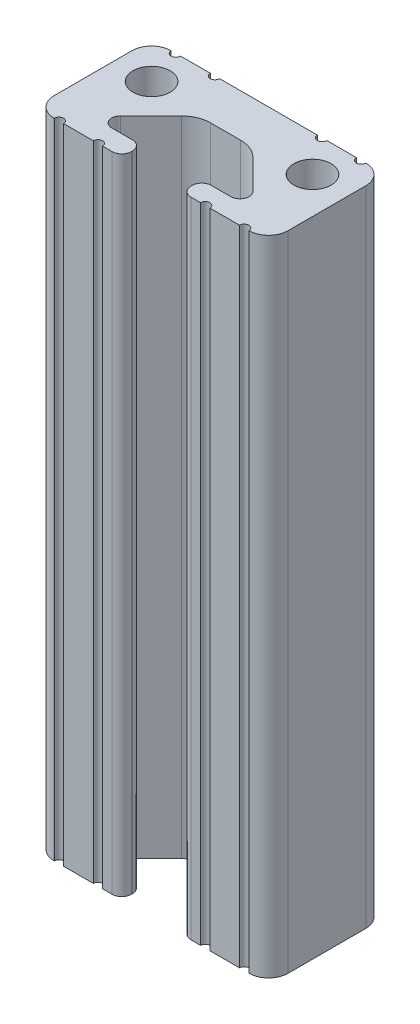
from build123d import *

# Parameters (mm, degrees)
SKETCH11_R                      = 2.032
F_10_1050_PROFILE_1_DEPTH       = 69.85
SKETCH14_R                      = 2.032
SKETCH14_R_2                    = 1.5
BOSS_EXTRUDE1_DEPTH             = 10
BOSS_EXTRUDE1_2_DEPTH           = 10
F_10_32_TAPPED_HOLE3_AT_2_COUNT = 2
F_10_32_TAPPED_HOLE3_AT_2_PITCH = 17.4752
SKETCH17_R                      = 2.032
SKETCH17_R_2                    = 1.25
BOSS_EXTRUDE2_DEPTH             = 10
BOSS_EXTRUDE2_2_DEPTH           = 10
F_10_32_TAPPED_HOLE4_AT_2_COUNT = 2
F_10_32_TAPPED_HOLE4_AT_2_PITCH = 17.4752


with BuildPart() as part:
    # Sketch11 → 10 1050 PROFILE(1) (new body)
    with BuildSketch(Plane(origin=(0, 0, 0), x_dir=(-1, 0, 0), z_dir=(0, 1, 0))):
        with BuildLine():
            Line((9.551093887, 6.35), (6.330982008, 6.35))
            ThreePointArc((6.330982008, 6.35), (5.824379679, 5.843397671), (5.31777735, 6.35))
            Line((5.31777735, 6.35), (4.28752, 6.35))
            ThreePointArc((4.28752, 6.35), (3.545750844, 6.042749156), (3.2385, 5.30098))
            Line((3.2385, 5.30098), (3.2385, 5.18922))
            ThreePointArc((3.2385, 5.18922), (3.545750844, 4.447450844), (4.28752, 4.1402))
            Line((4.28752, 4.1402), (6.541264932, 4.1402))
            ThreePointArc((6.541264932, 4.1402), (7.403778411, 3.563601238), (7.200674335, 2.54618079))
            Line((7.200674335, 2.54618079), (3.874487735, -0.773919123))
            ThreePointArc((3.874487735, -0.773919123), (2.845157282, -1.460673567), (1.631480681, -1.7018))
            Line((1.631480681, -1.7018), (-1.631480681, -1.7018))
            ThreePointArc((-1.631480681, -1.7018), (-2.845157282, -1.460673567), (-3.874487735, -0.773919123))
            Line((-3.874487735, -0.773919123), (-7.091634343, 2.437340333))
            ThreePointArc((-7.091634343, 2.437340333), (-7.30860647, 3.524230776), (-6.387200124, 4.1402))
            Line((-6.387200124, 4.1402), (-4.28752, 4.1402))
            ThreePointArc((-4.28752, 4.1402), (-3.545750844, 4.447450844), (-3.2385, 5.18922))
            Line((-3.2385, 5.18922), (-3.2385, 5.30098))
            ThreePointArc((-3.2385, 5.30098), (-3.545750844, 6.042749156), (-4.28752, 6.35))
            Line((-4.28752, 6.35), (-5.319235427, 6.35))
            ThreePointArc((-5.319235427, 6.35), (-5.825837756, 5.843397671), (-6.332440085, 6.35))
            Line((-6.332440085, 6.35), (-9.552501021, 6.35))
            ThreePointArc((-9.552501021, 6.35), (-10.056951984, 5.843402239), (-10.565687406, 6.345697309))
            Line((-10.565687406, 6.345697309), (-10.591304516, 6.345701455))
            ThreePointArc((-10.591304516, 6.345701455), (-12.082359481, 5.728298321), (-12.7, 4.237343309))
            Line((-12.7, 4.237343309), (-12.7, -4.233074923))
            ThreePointArc((-12.7, -4.233074923), (-12.072915167, -5.733409532), (-10.564685825, -6.341261141))
            ThreePointArc((-10.564685825, -6.341261141), (-10.053713904, -5.834598435), (-9.551557924, -6.35))
            Line((-9.551557924, -6.35), (-6.323021107, -6.35))
            ThreePointArc((-6.323021107, -6.35), (-5.816495529, -5.83457959), (-5.309969951, -6.35))
            Line((-5.309969951, -6.35), (5.309969951, -6.35))
            ThreePointArc((5.309969951, -6.35), (5.816495529, -5.83457959), (6.323021107, -6.35))
            Line((6.323021107, -6.35), (9.550160942, -6.35))
            ThreePointArc((9.550160942, -6.35), (10.051855758, -5.834602622), (10.563288148, -6.340338775))
            Line((10.563288148, -6.340338775), (10.589922543, -6.34049468))
            ThreePointArc((10.589922543, -6.34049468), (12.081868228, -5.723579066), (12.7, -4.23213684))
            Line((12.7, -4.23213684), (12.7, 4.244714967))
            ThreePointArc((12.7, 4.244714967), (12.082266163, 5.735759476), (10.591047766, 6.353073372))
            Line((10.591047766, 6.353073372), (10.564289268, 6.353065837))
            ThreePointArc((10.564289268, 6.353065837), (10.059229141, 5.84339999), (9.551093887, 6.35))
        make_face()
        with Locations((-8.7376, -2.3876)):
            Circle(SKETCH11_R, mode=Mode.SUBTRACT)
        with Locations((8.7376, -2.3876)):
            Circle(SKETCH11_R, mode=Mode.SUBTRACT)
    extrude(amount=F_10_1050_PROFILE_1_DEPTH)


with BuildPart() as body_2:
    # Sketch14 → Boss-Extrude1 (new body)
    with BuildSketch(Plane(origin=(0, 69.85, 0), x_dir=(1, 0, 0), z_dir=(0, 1, 0))):
        with Locations(Location((8.7376, 2.3876, 0), (0, 0, 270))):
            Circle(SKETCH14_R)
        with Locations(Location((8.7376, 2.3876, 0), (0, 0, 270))):
            Circle(SKETCH14_R_2, mode=Mode.SUBTRACT)
    extrude(amount=-BOSS_EXTRUDE1_DEPTH)


with BuildPart() as body_3:
    # Sketch14 → Boss-Extrude1 2 (new body)
    with BuildSketch(Plane(origin=(0, 69.85, 0), x_dir=(1, 0, 0), z_dir=(0, 1, 0))):
        with Locations(Location((-8.7376, 2.3876, 0), (0, 0, 270))):
            Circle(SKETCH14_R)
        with Locations(Location((-8.7376, 2.3876, 0), (0, 0, 270))):
            Circle(SKETCH14_R_2, mode=Mode.SUBTRACT)
    extrude(amount=-BOSS_EXTRUDE1_2_DEPTH)

    # Sketch16 → #10-32 Tapped Hole3 (revolve, cut)
    with BuildSketch(Plane(origin=(-8.7376, 69.85, -2.3876), x_dir=(0, 0, 1), z_dir=(1, 0, 0))):
        Polygon((0, 0), (0, 13.243317848), (2.0193, 12.03), (2.0193, 0), align=None)
    f_10_32_tapped_hole3 = revolve(axis=Axis((-8.7376, 76.2, -2.3876), (0, -1, 0)), mode=Mode.SUBTRACT)


with BuildPart() as body_2_1:
    add(body_2.part)

    # #10-32 Tapped Hole3 at 2: #10-32 Tapped Hole3 ×2
    with Locations(*[(i * F_10_32_TAPPED_HOLE3_AT_2_PITCH, 0, 0) for i in range(1, F_10_32_TAPPED_HOLE3_AT_2_COUNT)]):
        add(f_10_32_tapped_hole3, mode=Mode.SUBTRACT)


with BuildPart() as body_4:
    # Sketch17 → Boss-Extrude2 (new body)
    with BuildSketch(Plane.XZ):
        with Locations(Location((-8.7376, -2.3876, 0), (0, 0, 270))):
            Circle(SKETCH17_R)
        with Locations(Location((-8.7376, -2.3876, 0), (0, 0, 270))):
            Circle(SKETCH17_R_2, mode=Mode.SUBTRACT)
    extrude(amount=-BOSS_EXTRUDE2_DEPTH)

    # Sketch19 → #10-32 Tapped Hole4 (revolve, cut)
    with BuildSketch(Plane(origin=(-8.7376, 0, -2.3876), x_dir=(0, 0, -1), z_dir=(1, 0, 0))):
        Polygon((0, 0), (0, 13.243317848), (2.0193, 12.03), (2.0193, 0), align=None)
    f_10_32_tapped_hole4 = revolve(axis=Axis((-8.7376, -6.35, -2.3876), (0, 1, 0)), mode=Mode.SUBTRACT)


with BuildPart() as body_5:
    # Sketch17 → Boss-Extrude2 2 (new body)
    with BuildSketch(Plane.XZ):
        with Locations(Location((8.7376, -2.3876, 0), (0, 0, 270))):
            Circle(SKETCH17_R)
        with Locations(Location((8.7376, -2.3876, 0), (0, 0, 270))):
            Circle(SKETCH17_R_2, mode=Mode.SUBTRACT)
    extrude(amount=-BOSS_EXTRUDE2_2_DEPTH)

    # #10-32 Tapped Hole4 at 2: #10-32 Tapped Hole4 ×2
    with Locations(*[(i * F_10_32_TAPPED_HOLE4_AT_2_PITCH, 0, 0) for i in range(1, F_10_32_TAPPED_HOLE4_AT_2_COUNT)]):
        add(f_10_32_tapped_hole4, mode=Mode.SUBTRACT)


solid = Compound([part.part, body_3.part, body_2_1.part, body_4.part, body_5.part])
